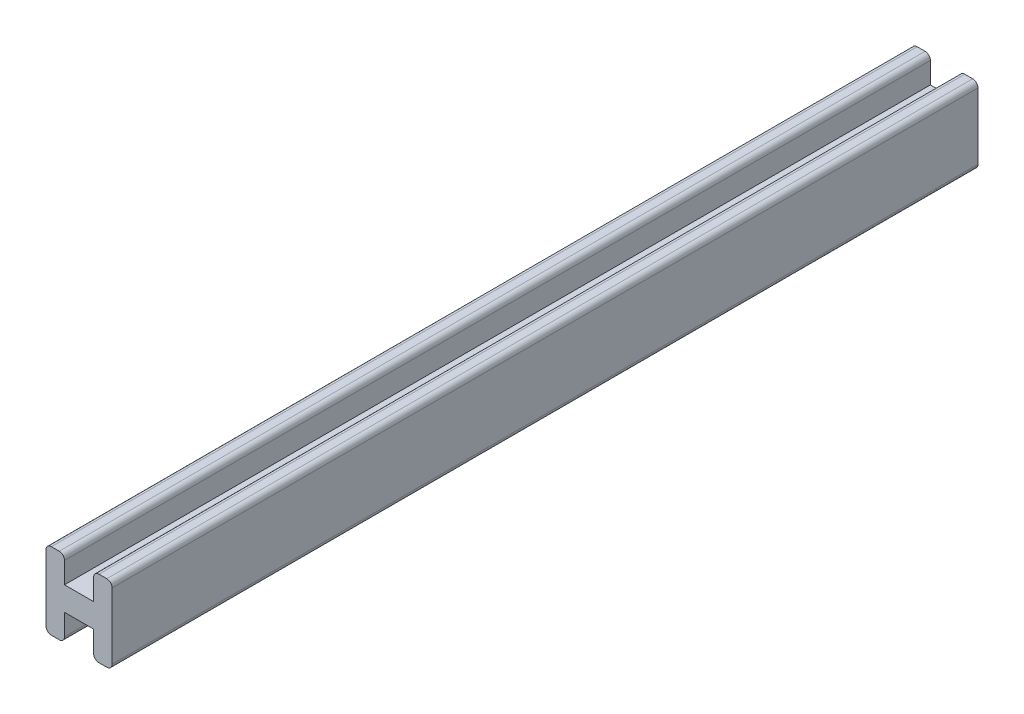
from build123d import *

# Parameters (mm, degrees)
BOSS_EXTRUDE1_DEPTH = 21
CUT_EXTRUDE1_DEPTH  = 22.662179022
BOSS_EXTRUDE2_DEPTH = 49
FILLET1_R           = 0.4
SKETCH4_W           = 7.390362968
SKETCH4_H           = 6.925637862
CUT_EXTRUDE2_DEPTH  = 4.5


with BuildPart() as part:
    # Sketch1 → Boss-Extrude1 (new body)
    with BuildSketch(Plane.XY):
        Polygon((0, 0), (2, 0), (2, 2), (3.5, 2), (3.5, -4), (2, -4), (2, -2), (0, -2), (0, -4), (-1.5, -4), (-1.5, 2), (0, 2), align=None)
    extrude(amount=BOSS_EXTRUDE1_DEPTH)

    # Sketch2 → Cut-Extrude1 (cut, through all)
    with BuildSketch(Plane.XY.offset(21)):
        Polygon((-1.5, 2), (-1.5, 1.9), (-0.1, 1.9), (-0.1, -0.1), (2.1, -0.1), (2.1, 1.9), (3.5, 1.9), (3.5, 2), align=None)
        Polygon((-1.5, -4), (3.5, -4), (3.5, -3.9), (2.1, -3.9), (2.1, -1.9), (-0.1, -1.9), (-0.1, -3.9), (-1.5, -3.9), align=None)
    extrude(amount=-CUT_EXTRUDE1_DEPTH, mode=Mode.SUBTRACT)

    # Sketch3 → Boss-Extrude2 (add)
    with BuildSketch(Plane(origin=(0, 0, 0), x_dir=(-1, 0, 0), z_dir=(0, 0, -1))):
        Polygon((-2.1, -0.1), (-2.1, 1.9), (-3.5, 1.9), (-3.5, -3.9), (-2.1, -3.9), (-2.1, -1.9), (0.1, -1.9), (0.1, -3.9), (1.5, -3.9), (1.5, 1.9), (0.1, 1.9), (0.1, -0.1), align=None)
    extrude(amount=BOSS_EXTRUDE2_DEPTH)

    # Fillet1
    fillet1_edges = [part.edges().sort_by_distance(p)[0] for p in [
        (3.5, 1.9, -14),
        (2.1, 1.9, -14),
        (-0.1, 1.9, -14),
        (-1.5, 1.9, -14),
        (-1.5, -3.9, -14),
        (-0.1, -3.9, -14),
        (2.1, -3.9, -14),
        (3.5, -3.9, -14),
    ]]
    fillet(fillet1_edges, radius=FILLET1_R)

    # Sketch4 → Cut-Extrude2 (cut)
    with BuildSketch(Plane.XY.offset(21)):
        with Locations((1.359853511, -0.992123471)):
            Rectangle(SKETCH4_W, SKETCH4_H)
    extrude(amount=-CUT_EXTRUDE2_DEPTH, mode=Mode.SUBTRACT)


solid = part.part
